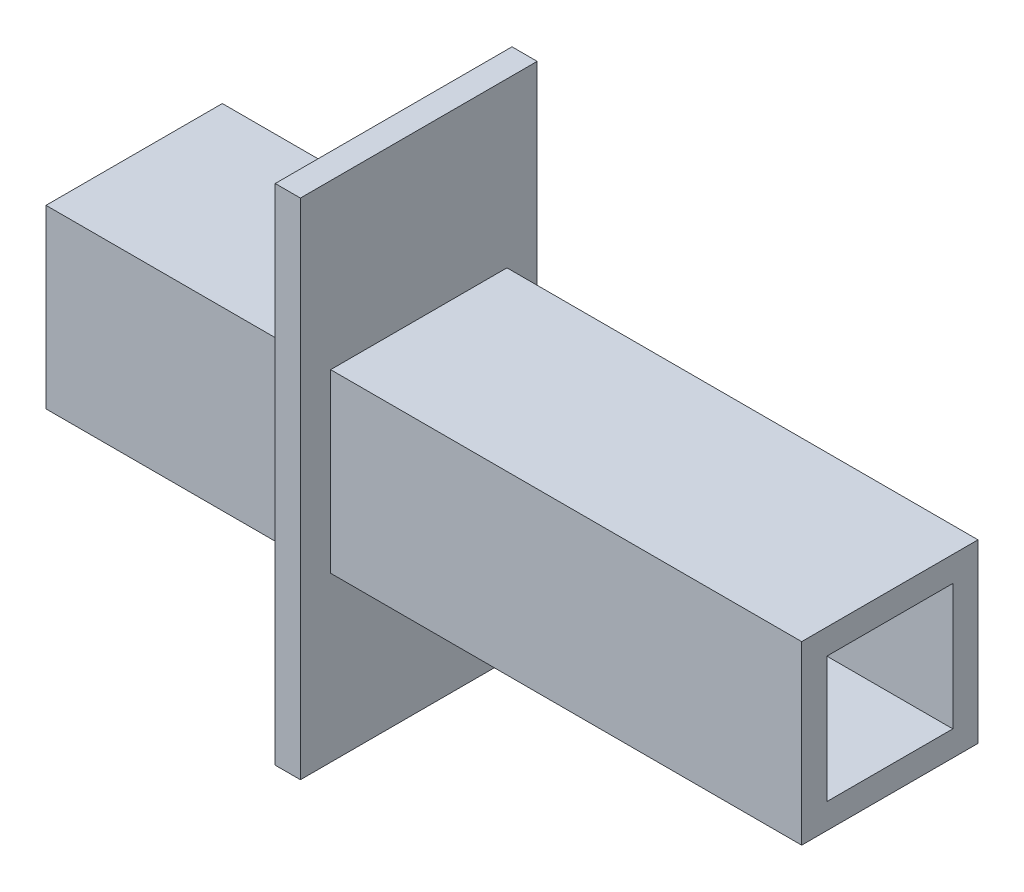
from build123d import *

# Parameters (mm, degrees)
CROQUIS1_W              = 3.5
CROQUIS1_H              = 3.5
SALIENTE_EXTRUIR1_DEPTH = 15
CROQUIS4_W              = 4.7
CROQUIS4_H              = 10
SALIENTE_EXTRUIR2_DEPTH = 0.5
CROQUIS5_W              = 2.5
CROQUIS5_H              = 2.5
CORTAR_EXTRUIR1_DEPTH   = 14


with BuildPart() as part:
    # Croquis1 → Saliente-Extruir1 (new body)
    with BuildSketch(Plane(origin=(0, 0, 0), x_dir=(0, 0, -1), z_dir=(1, 0, 0))):
        with Locations((0, 1.75)):
            Rectangle(CROQUIS1_W, CROQUIS1_H)
    extrude(amount=SALIENTE_EXTRUIR1_DEPTH)

    # Croquis4 → Saliente-Extruir2 (add)
    with BuildSketch(Plane.ZY.offset(-5.15)):
        with Locations((0, 1.75)):
            Rectangle(CROQUIS4_W, CROQUIS4_H)
    extrude(amount=-SALIENTE_EXTRUIR2_DEPTH)

    # Croquis5 → Cortar-Extruir1 (cut)
    with BuildSketch(Plane(origin=(15, 0, 0), x_dir=(0, 0, -1), z_dir=(1, 0, 0))):
        with Locations((0, 1.75)):
            Rectangle(CROQUIS5_W, CROQUIS5_H)
    extrude(amount=-CORTAR_EXTRUIR1_DEPTH, mode=Mode.SUBTRACT)


solid = part.part
